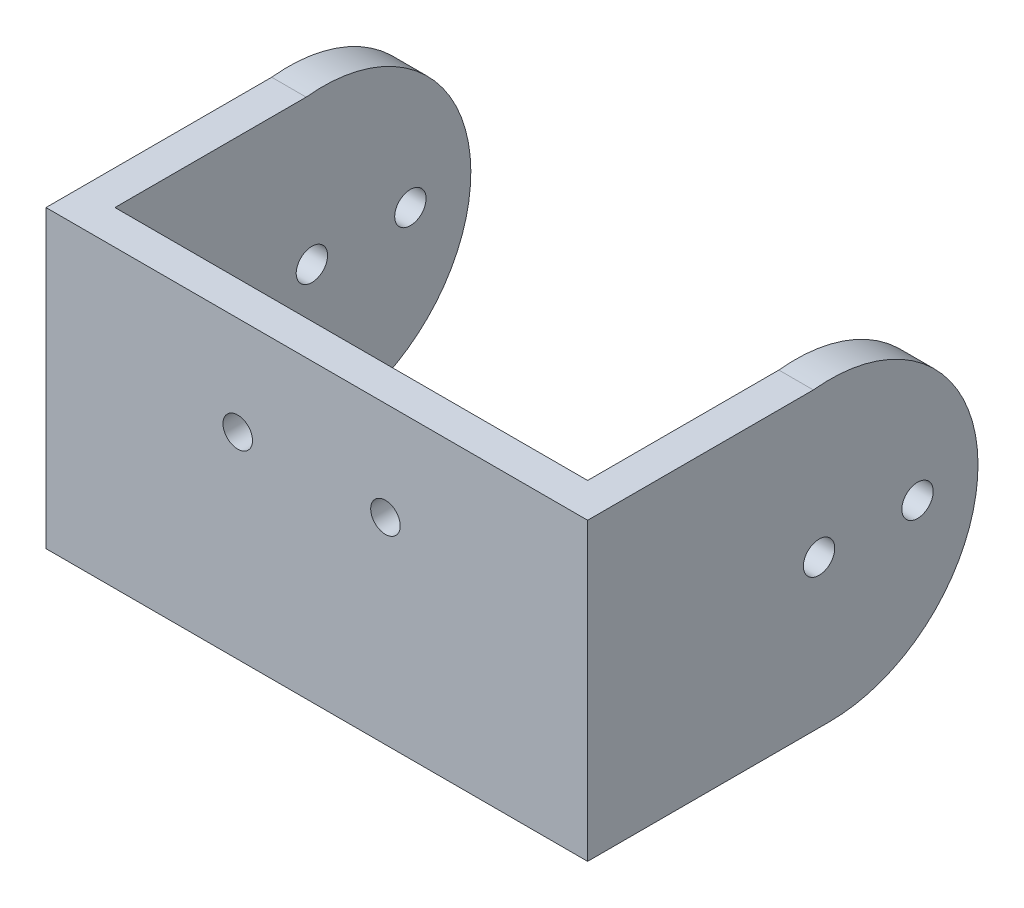
from build123d import *

# Parameters (mm, degrees)
SKETCH_1_W          = 55
SKETCH_1_H          = 30
EXTRUDE_1_DEPTH     = 3.5
SKETCH_2_R          = 1.592723526
EXTRUDE_2_DEPTH     = 3.5
SKETCH_3_R          = 1.5
CUT_EXTRUDE_1_DEPTH = 3.5


with BuildPart() as part:
    # 草图1 → 凸台-拉伸1 (new body)
    with BuildSketch(Plane.XY):
        Rectangle(SKETCH_1_W, SKETCH_1_H)
    extrude(amount=EXTRUDE_1_DEPTH)

    # 草图2 → 凸台-拉伸2 (add)
    with BuildSketch(Plane(origin=(27.5, 0, 0), x_dir=(0, 0, -1), z_dir=(1, 0, 0))):
        with BuildLine():
            Line((0, 15), (0, -15))
            Line((0, -15), (21, -15))
            ThreePointArc((21, -15), (36.119015722, 0.838004237), (19.419767517, 15))
            Line((19.419767517, 15), (0, 15))
        make_face()
        with Locations((20, 0)):
            Circle(SKETCH_2_R, mode=Mode.SUBTRACT)
        with Locations(Location((30, 0, 0), (0, 0, 180))):
            Circle(SKETCH_2_R, mode=Mode.SUBTRACT)
    extrude_2 = extrude(amount=-EXTRUDE_2_DEPTH)

    # 镜向1: 凸台-拉伸2 across plane
    add(extrude_2.mirror(Plane(origin=(0, 0, 0), x_dir=(0, 0, 1), z_dir=(1, 0, 0))))

    # 草图3 → 切除-拉伸1 (cut)
    with BuildSketch(Plane.XY.offset(3.5)):
        with Locations(Location((6.970033691, 4.99, 0), (0, 0, 180))):
            Circle(SKETCH_3_R)
        with Locations(Location((-8.029966309, 4.99, 0), (0, 0, 180))):
            Circle(SKETCH_3_R)
    extrude(amount=-CUT_EXTRUDE_1_DEPTH, mode=Mode.SUBTRACT)


solid = part.part
